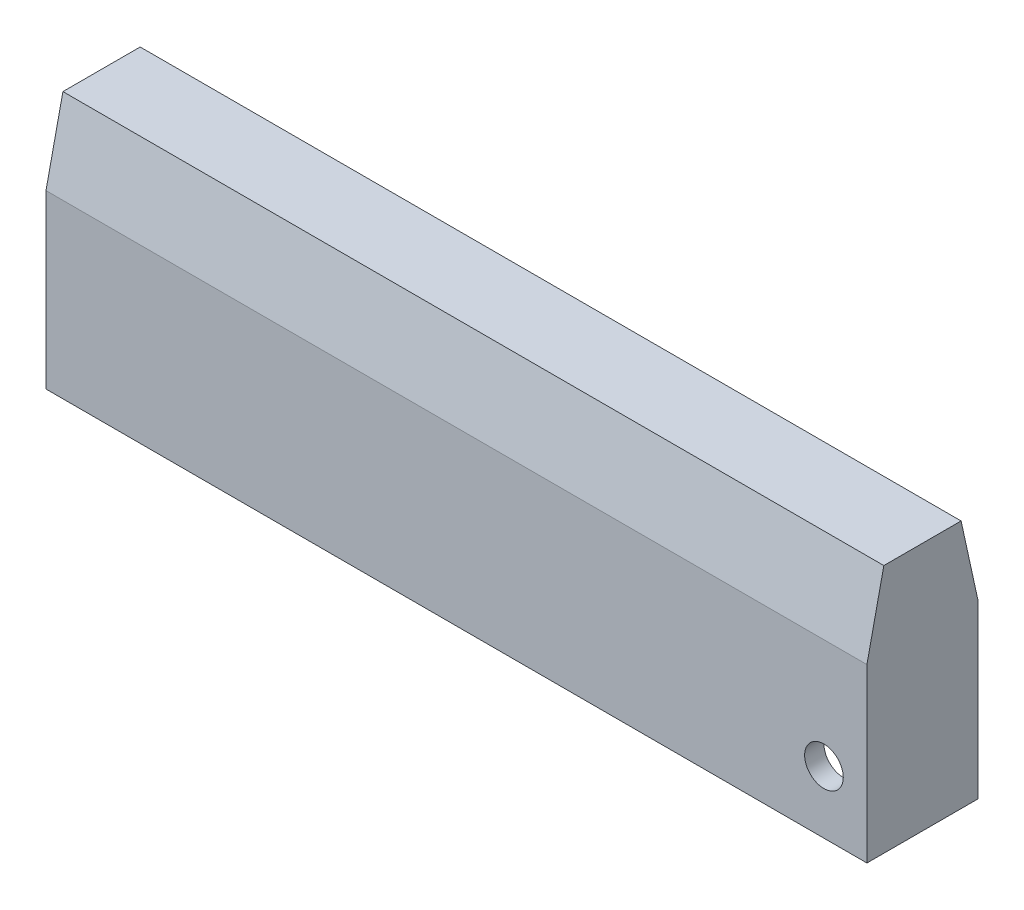
from build123d import *

# Parameters (mm, degrees)
BOSS_EXTRUDE1_DEPTH      = 8
BOSS_EXTRUDE1_DEPTH_BACK = 17.8
SKETCH1_W                = 138
SKETCH1_H                = 11.5
SKETCH8_R                = 2
CUT_EXTRUDE4_DEPTH       = 11.5
CHAMFER2_SIZE            = 8
CHAMFER2_SIZE2           = 1.75
CHAMFER3_SIZE            = 1.75
CHAMFER3_SIZE2           = 8
CUT_EXTRUDE5_REACH       = 75.89
SKETCH11_W               = 53
SKETCH11_H               = 11.5
SKETCH12_W               = 81
SKETCH12_H               = 7.5
CUT_EXTRUDE6_DEPTH       = 17.8
SKETCH13_W               = 40.5
SKETCH13_H               = 2
BOSS_EXTRUDE3_DEPTH      = 7.5


with BuildPart() as part:
    # Sketch1 → Boss-Extrude1 (new, two sides: drawn at the far end of the back side and taken through both)
    with BuildSketch(Plane(origin=(0, 0, 0), x_dir=(1, 0, 0), z_dir=(0, 1, 0)).offset(-BOSS_EXTRUDE1_DEPTH_BACK)):
        Rectangle(SKETCH1_W, SKETCH1_H)
    extrude(amount=BOSS_EXTRUDE1_DEPTH + BOSS_EXTRUDE1_DEPTH_BACK)

    # Sketch8 → Cut-Extrude4 (cut)
    with BuildSketch(Plane.XY.offset(5.75)):
        with Locations((64.55, -11.35)):
            Circle(SKETCH8_R)
    extrude(amount=-CUT_EXTRUDE4_DEPTH, mode=Mode.SUBTRACT)

    # Chamfer2
    chamfer2_edges = [part.edges().sort_by_distance(p)[0] for p in [
        (0, 8, 5.75),
    ]]
    chamfer2_side = [part.faces().sort_by_distance(p)[0] for p in [
        (-0.228635079, -4.877154202, 5.75),
    ]]
    chamfer(chamfer2_edges, length=CHAMFER2_SIZE, length2=CHAMFER2_SIZE2, reference=chamfer2_side[0])

    # Chamfer3
    chamfer3_edges = [part.edges().sort_by_distance(p)[0] for p in [
        (0, 8, -5.75),
    ]]
    chamfer3_side = [part.faces().sort_by_distance(p)[0] for p in [
        (0, 8, -0.875),
    ]]
    chamfer(chamfer3_edges, length=CHAMFER3_SIZE, length2=CHAMFER3_SIZE2, reference=chamfer3_side[0])

    # Cut-Extrude5: up to this face of the body (flat: up to its plane)
    cut_extrude5_end = Plane(part.part.faces().sort_by_distance((0, 8, 0))[0])
    # Sketch11 → Cut-Extrude5 (cut, up to the picked face)
    with BuildSketch(Plane.XZ.offset(17.8), mode=Mode.PRIVATE) as cut_extrude5_sk1:
        with Locations((-42.5, 0)):
            Rectangle(SKETCH11_W, SKETCH11_H)
    cut_extrude5_tool1 = split(extrude(cut_extrude5_sk1.sketch, amount=-CUT_EXTRUDE5_REACH, mode=Mode.PRIVATE), bisect_by=cut_extrude5_end, keep=Keep.BOTH, mode=Mode.PRIVATE)
    add(cut_extrude5_tool1.solids().sort_by(Axis((-42.5, -17.8, 0), (0, 1, 0)))[0], mode=Mode.SUBTRACT)

    # Sketch12 → Cut-Extrude6 (cut)
    with BuildSketch(Plane.XZ.offset(17.8)):
        with Locations((26.5, 0)):
            Rectangle(SKETCH12_W, SKETCH12_H)
    extrude(amount=-CUT_EXTRUDE6_DEPTH, mode=Mode.SUBTRACT)

    # Sketch13 → Boss-Extrude3 (add)
    with BuildSketch(Plane.XY.offset(-3.75)):
        with Locations((6.25, -13.3)):
            Rectangle(SKETCH13_W, SKETCH13_H)
    extrude(amount=BOSS_EXTRUDE3_DEPTH)


solid = part.part
